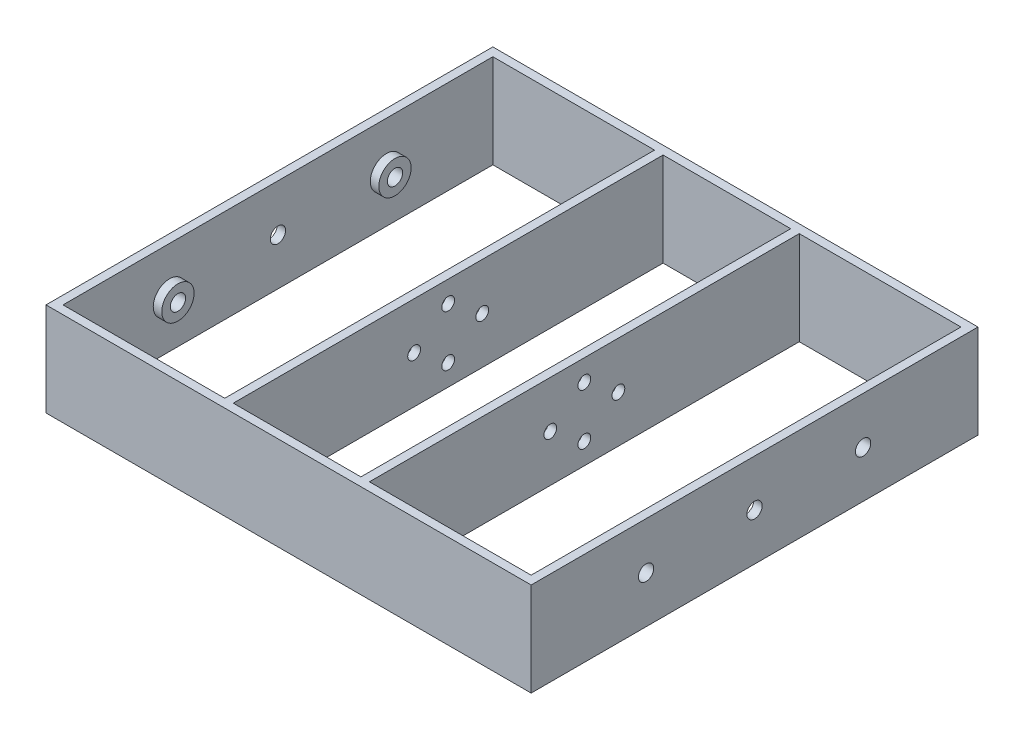
from build123d import *
from build123d.topology import SkipClean

# Parameters (mm, degrees)
BOSS_EXTRUDE1_START = 55
SKETCH2_W           = 105
SKETCH2_H           = 22
SKETCH2_R           = 1.8
BOSS_EXTRUDE1_DEPTH = 2
BOSS_EXTRUDE2_START = 2
SKETCH3_R           = 3.8
SKETCH3_R_2         = 1.8
BOSS_EXTRUDE2_DEPTH = 2
BOSS_EXTRUDE3_START = 15
SKETCH5_W           = 105
SKETCH5_H           = 22
SKETCH5_R           = 1.5
BOSS_EXTRUDE3_DEPTH = 2
SKETCH6_W           = 114
SKETCH6_H           = 2
BOSS_EXTRUDE4_DEPTH = 11


with BuildPart() as part:
    # Sketch2 → Boss-Extrude1 (new body)
    with BuildSketch(Plane(origin=(0, 0, 0), x_dir=(0, 0, -1), z_dir=(1, 0, 0)).offset(BOSS_EXTRUDE1_START)):
        Rectangle(SKETCH2_W, SKETCH2_H)
        Circle(SKETCH2_R, mode=Mode.SUBTRACT)
        with Locations((-25.5, 0)):
            Circle(SKETCH2_R, mode=Mode.SUBTRACT)
        with Locations((25.5, 0)):
            Circle(SKETCH2_R, mode=Mode.SUBTRACT)
    extrude(amount=BOSS_EXTRUDE1_DEPTH)

    # Sketch3 → Boss-Extrude2 (add)
    # profile 1 of 2: a face of its own
    with SkipClean():  # the faces are left unmerged after this step: merging them gives an invalid solid
        with BuildSketch(Plane.ZY.offset(-55).offset(BOSS_EXTRUDE2_START)):
            with Locations((-25.5, 0)):
                Circle(SKETCH3_R)
            with Locations((-25.5, 0)):
                Circle(SKETCH3_R_2, mode=Mode.SUBTRACT)
        # profile 2 of 2: a face of its own
        with BuildSketch(Plane.ZY.offset(-55).offset(BOSS_EXTRUDE2_START)):
            with Locations((25.5, 0)):
                Circle(SKETCH3_R)
            with Locations((25.5, 0)):
                Circle(SKETCH3_R_2, mode=Mode.SUBTRACT)
        extrude(amount=-BOSS_EXTRUDE2_DEPTH)


with BuildPart() as body_2:
    # Sketch5 → Boss-Extrude3 (new body)
    with BuildSketch(Plane(origin=(0, 0, 0), x_dir=(0, 0, -1), z_dir=(1, 0, 0)).offset(BOSS_EXTRUDE3_START)):
        Rectangle(SKETCH5_W, SKETCH5_H)
        with Locations((8, 0)):
            Circle(SKETCH5_R, mode=Mode.SUBTRACT)
        with Locations((-8, 0)):
            Circle(SKETCH5_R, mode=Mode.SUBTRACT)
        with Locations((0, 6)):
            Circle(SKETCH5_R, mode=Mode.SUBTRACT)
        with Locations((0, -6)):
            Circle(SKETCH5_R, mode=Mode.SUBTRACT)
    extrude(amount=BOSS_EXTRUDE3_DEPTH)


with BuildPart() as body_3:
    # Mirror2: mirrored copy
    add(part.part.mirror(Plane(origin=(0, 0, 0), x_dir=(0, 0, 1), z_dir=(1, 0, 0))))


with BuildPart() as body_4:
    # Mirror2 2: mirrored copy
    add(body_2.part.mirror(Plane(origin=(0, 0, 0), x_dir=(0, 0, 1), z_dir=(1, 0, 0))))


with BuildPart() as part_1:
    with SkipClean():  # the faces are left unmerged after this step: merging them gives an invalid solid
        add(part.part)

        add(body_2.part)  # Boss-Extrude4 merges body 2

        add(body_3.part)  # Boss-Extrude4 merges body 3

        add(body_4.part)  # Boss-Extrude4 merges body 4
        # Sketch6 → Boss-Extrude4 (add, symmetric)
        with BuildSketch(Plane(origin=(0, 0, 0), x_dir=(1, 0, 0), z_dir=(0, 1, 0))):
            with Locations((0, -51.5)):
                Rectangle(SKETCH6_W, SKETCH6_H)
            with Locations((0, 51.5)):
                Rectangle(SKETCH6_W, SKETCH6_H)
        extrude(amount=BOSS_EXTRUDE4_DEPTH, both=True)


solid = part_1.part
